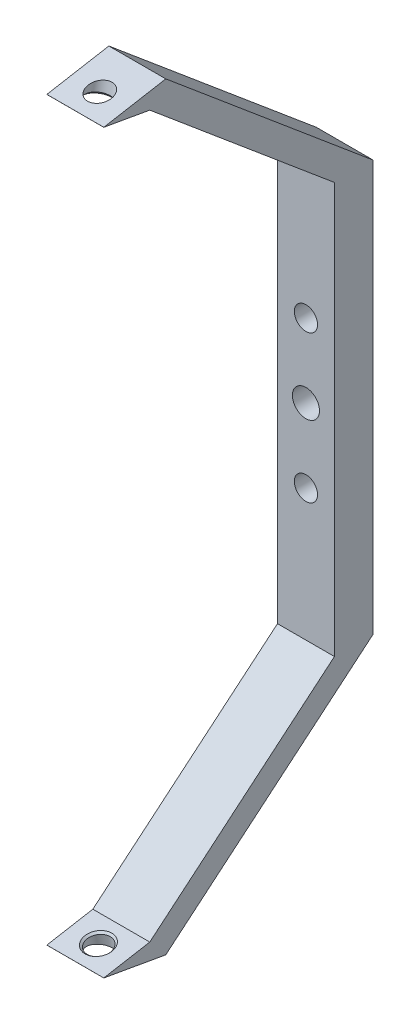
from build123d import *

# Parameters (mm, degrees)
ESQUISSE1_W             = 7.35
ESQUISSE1_H             = 53
BOSS_EXTRU_1_DEPTH      = 5
ESQUISSE3_R             = 1.5
ENL_V_MAT_EXTRU_1_DEPTH = 28.216826138
ESQUISSE4_R             = 1.75
ENL_V_MAT_EXTRU_2_DEPTH = 28.216826138
BOSS_EXTRU_2_DEPTH      = 7.35
BOSS_EXTRU_4_DEPTH      = 7.35
ENL_V_MAT_EXTRU_4_REACH = 80.802
ESQUISSE10_R            = 1.5
BOSS_EXTRU_5_DEPTH      = 7.35
ESQUISSE12_R            = 1.5
ENL_V_MAT_EXTRU_5_DEPTH = 7.35
CHANFREIN2_SIZE         = 0.25


with BuildPart() as part:
    # Esquisse1 → Boss.-Extru.1 (new body)
    with BuildSketch(Plane.XY):
        Rectangle(ESQUISSE1_W, ESQUISSE1_H)
    extrude(amount=BOSS_EXTRU_1_DEPTH)

    # Esquisse3 → Enlèv. mat.-Extru.1 (cut, through all)
    with BuildSketch(Plane(origin=(0, 0, 0), x_dir=(-1, 0, 0), z_dir=(0, 0, -1))):
        with Locations((0, 9.5)):
            Circle(ESQUISSE3_R)
        with Locations((0, -9.5)):
            Circle(ESQUISSE3_R)
    extrude(amount=-ENL_V_MAT_EXTRU_1_DEPTH, mode=Mode.SUBTRACT)

    # Esquisse4 → Enlèv. mat.-Extru.2 (cut, through all)
    with BuildSketch(Plane.XY.offset(5)):
        Circle(ESQUISSE4_R)
    extrude(amount=-ENL_V_MAT_EXTRU_2_DEPTH, mode=Mode.SUBTRACT)

    # Esquisse5 → Boss.-Extru.2 (add, through all)
    with BuildSketch(Plane.ZY.offset(3.675)):
        Polygon((5, -26.5), (28.835071852, -46.5), (26.769192296, -48.962019383), (0, -26.5), align=None)
    extrude(amount=-BOSS_EXTRU_2_DEPTH)

    # Esquisse8 → Boss.-Extru.4 (add)
    with BuildSketch(Plane.ZY.offset(3.675)):
        with BuildLine():
            Line((26.769192296, -48.962019383), (34.769192296, -47.551403537))
            ThreePointArc((34.769192296, -47.551403537), (34.771314377, -47.548874539), (34.769192296, -47.546345541))
            Line((34.769192296, -47.546345541), (28.835071852, -46.5))
            Line((28.835071852, -46.5), (26.769192296, -48.962019383))
        make_face()
    extrude(amount=-BOSS_EXTRU_4_DEPTH)

    # Enlèv. mat.-Extru.4: up to this plane
    enl_v_mat_extru_4_end = Plane(origin=(12.047305372, -48.962019383, 26.769192296), z_dir=(0, -0.9848077530122071, 0.17364817766693624))
    # Esquisse10 → Enlèv. mat.-Extru.4 (cut, up to the surface)
    with BuildSketch(Plane(origin=(0, -40.166765729, -7.082484526), x_dir=(1, 0, 0), z_dir=(0, 0.9848077530122085, 0.1736481776669283)), mode=Mode.PRIVATE) as enl_v_mat_extru_4_sk1:
        with Locations(Location((0, -39.47164258, 0), (0, 0, 270))):
            Circle(ESQUISSE10_R)
    enl_v_mat_extru_4_tool1 = split(extrude(enl_v_mat_extru_4_sk1.sketch, amount=-ENL_V_MAT_EXTRU_4_REACH, mode=Mode.PRIVATE), bisect_by=enl_v_mat_extru_4_end, keep=Keep.BOTH, mode=Mode.PRIVATE)
    add(enl_v_mat_extru_4_tool1.solids().sort_by_distance((0, -47.020945, 31.789495))[0], mode=Mode.SUBTRACT)

    # Esquisse11 → Boss.-Extru.5 (add)
    with BuildSketch(Plane(origin=(3.675, 0, 0), x_dir=(0, 0, -1), z_dir=(1, 0, 0))):
        with BuildLine():
            ThreePointArc((-34.769192296, 47.546345541), (-34.771314377, 47.548874539), (-34.769192296, 47.551403537))
            Line((-34.769192296, 47.551403537), (-26.769192296, 48.962019383))
            Line((-26.769192296, 48.962019383), (0, 26.5))
            Line((0, 26.5), (-5, 26.5))
            Line((-5, 26.5), (-28.835071852, 46.5))
            Line((-28.835071852, 46.5), (-34.769192296, 47.546345541))
        make_face()
    extrude(amount=-BOSS_EXTRU_5_DEPTH)

    # Esquisse12 → Enlèv. mat.-Extru.5 (cut)
    with BuildSketch(Plane(origin=(0, 40.166765729, -7.082484526), x_dir=(1, 0, 0), z_dir=(0, -0.9848077530122044, 0.17364817766695173))):
        with Locations(Location((0, 39.484474488, 0), (0, 0, 270))):
            Circle(ESQUISSE12_R)
    extrude(amount=-ENL_V_MAT_EXTRU_5_DEPTH, mode=Mode.SUBTRACT)

    # Chanfrein2
    chanfrein2_edges = [part.edges().sort_by_distance(p)[0] for p in [
        (0, -46.760472266, 30.312283481),
        (0, 47.283645037, 33.279343703),
    ]]
    chamfer(chanfrein2_edges, length=CHANFREIN2_SIZE)


solid = part.part
